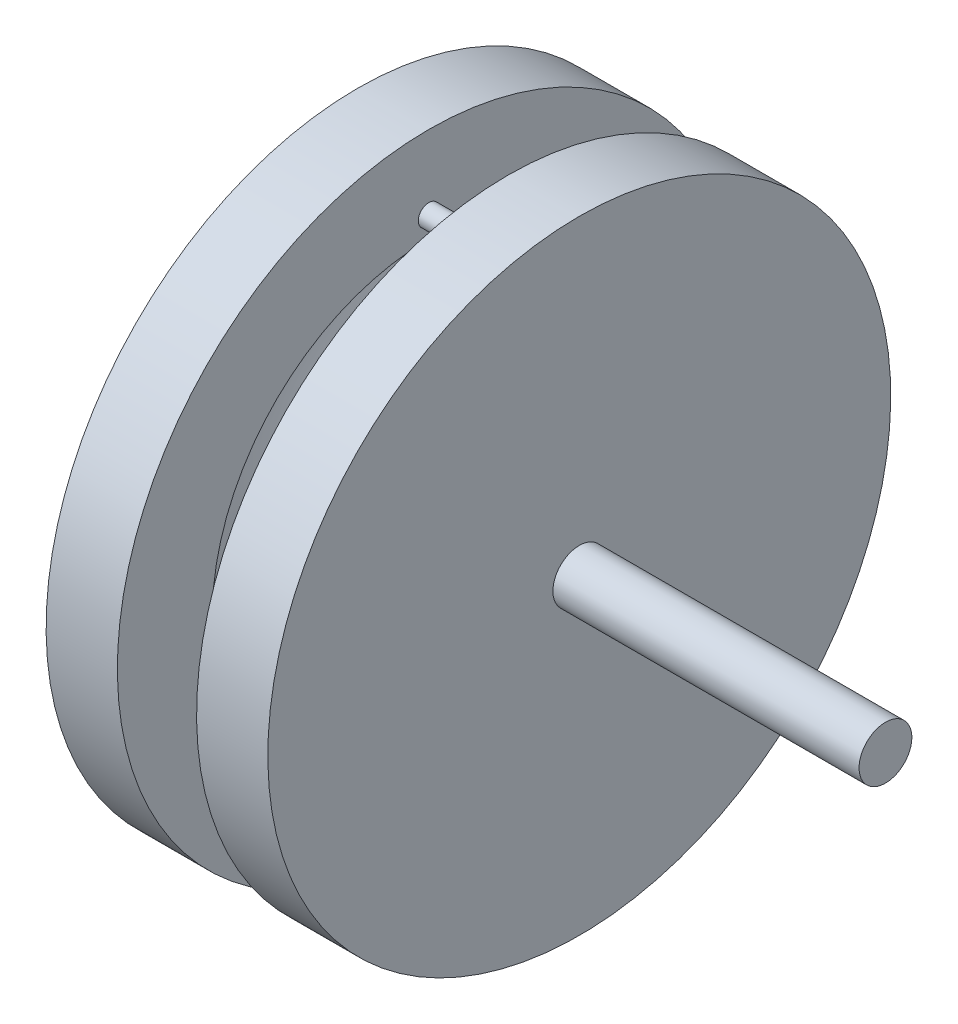
from build123d import *

# Parameters (mm, degrees)
SKETCH_1_W      = 29
SKETCH_1_H      = 2.5
SKETCH_2_R      = 1
EXTRUDE_1_DEPTH = 20


with BuildPart() as part:
    # 草图1 → 旋转1 (revolve)
    with BuildSketch(Plane.XY):
        with BuildLine():
            add(Edge.make_bspline(
                [(-14.25, 20.5), (-10.271097928, 9.254557994), (-6.75, 21)],
                knots=[0, 0, 0, 1, 1, 1], degree=2))
            Line((-6.75, 21), (-6.75, 29.5))
            Line((-6.75, 29.5), (0, 29.5))
            Line((0, 29.5), (0, 0))
            Line((0, 0), (-21, 0))
            Line((-21, 0), (-21, 29.5))
            Line((-21, 29.5), (-14.25, 29.5))
            Line((-14.25, 29.5), (-14.25, 20.5))
        make_face()
        with Locations((14.5, 1.25)):
            Rectangle(SKETCH_1_W, SKETCH_1_H)
    revolve(axis=Axis((0, 0, 0), (-1, 0, 0)))

    # 草图2 → 凸台-拉伸1 (add)
    with BuildSketch(Plane(origin=(0, 0, 0), x_dir=(0, 0, -1), z_dir=(1, 0, 0))):
        with Locations(Location((0, 22.5, 0), (0, 0, 270))):
            Circle(SKETCH_2_R)
        with Locations(Location((0, -22.5, 0), (0, 0, 270))):
            Circle(SKETCH_2_R)
    extrude(amount=-EXTRUDE_1_DEPTH)


solid = part.part
